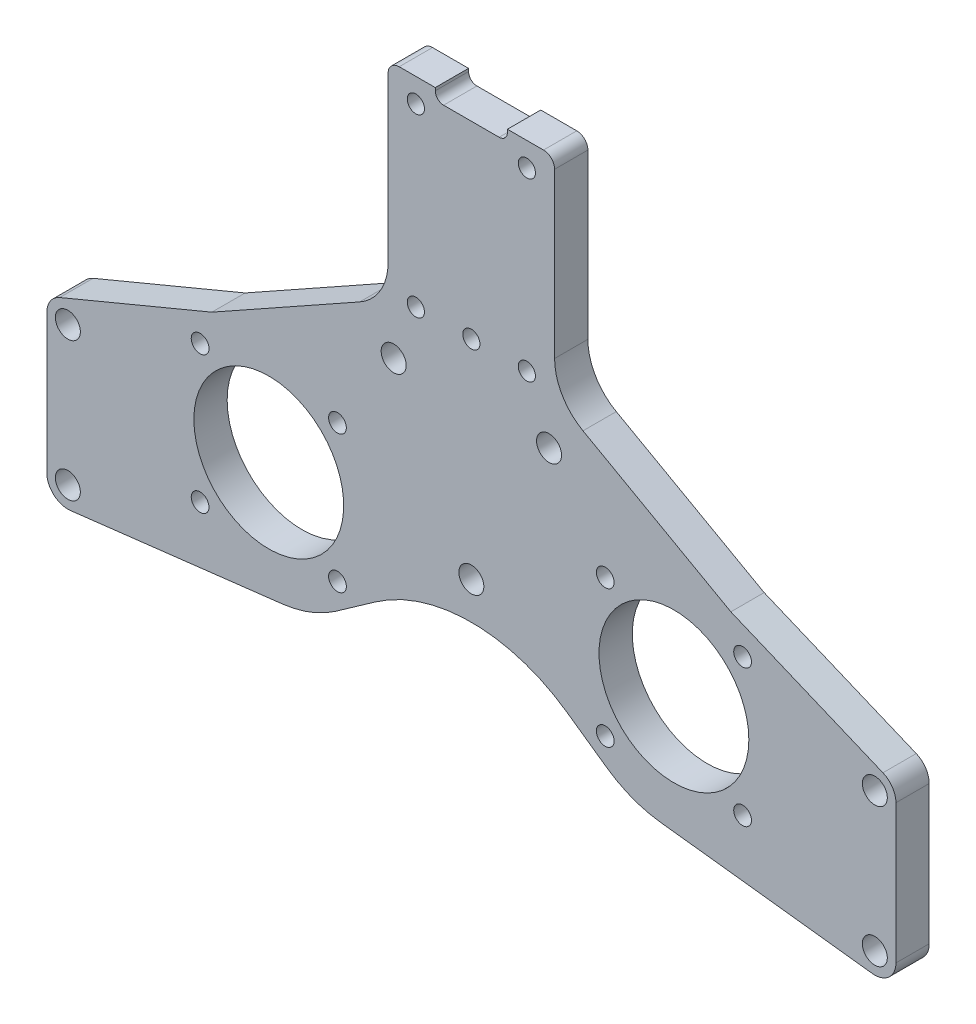
from build123d import *

# Parameters (mm, degrees)
SKETCH_1_R          = 2.25
SKETCH_1_R_2        = 13.5
SKETCH_1_R_3        = 1.6
SKETCH_1_R_4        = 1.55
EXTRUDE_1_DEPTH     = 6
SKETCH_2_R          = 2.25
EXTRUDE_2_DEPTH     = 6
CUT_EXTRUDE_2_DEPTH = 10


with BuildPart() as part:
    # 草图1 → 凸台-拉伸1 (new body)
    with BuildSketch(Plane.XY):
        with BuildLine():
            Line((-20.113876697, 33.24519052), (-46.760858936, 18.322520948))
            ThreePointArc((-46.760858936, 18.322520948), (-54.272689389, -11.186219731), (-24.417808219, -17.176164932))
            Line((-24.417808219, -17.176164932), (-17.260273973, -12.141356418))
            ThreePointArc((-17.260273973, -12.141356418), (0, -6.678734892), (17.260273973, -12.141356418))
            Line((17.260273973, -12.141356418), (24.417808219, -17.176164932))
            ThreePointArc((24.417808219, -17.176164932), (54.272689389, -11.186219731), (46.760858936, 18.322520948))
            Line((46.760858936, 18.322520948), (20.113876697, 33.24519052))
            ThreePointArc((20.113876697, 33.24519052), (16.372681963, 36.913582704), (15, 41.970200496))
            Line((15, 41.970200496), (15, 71.5))
            ThreePointArc((15, 71.5), (14.414213562, 72.914213562), (13, 73.5))
            Line((13, 73.5), (-13, 73.5))
            ThreePointArc((-13, 73.5), (-14.414213562, 72.914213562), (-15, 71.5))
            Line((-15, 71.5), (-15, 41.970200496))
            ThreePointArc((-15, 41.970200496), (-16.372681963, 36.913582704), (-20.113876697, 33.24519052))
        make_face()
        with Locations((-14, 27.5)):
            Circle(SKETCH_1_R, mode=Mode.SUBTRACT)
        with Locations((14, 27.5)):
            Circle(SKETCH_1_R, mode=Mode.SUBTRACT)
        with Locations((36.5, 0)):
            Circle(SKETCH_1_R_2, mode=Mode.SUBTRACT)
        with Locations((24.125631329, 12.374368671)):
            Circle(SKETCH_1_R_3, mode=Mode.SUBTRACT)
        with Locations((48.874368671, 12.374368671)):
            Circle(SKETCH_1_R_3, mode=Mode.SUBTRACT)
        with Locations((48.874368671, -12.374368671)):
            Circle(SKETCH_1_R_3, mode=Mode.SUBTRACT)
        with Locations((24.125631329, -12.374368671)):
            Circle(SKETCH_1_R_3, mode=Mode.SUBTRACT)
        Circle(SKETCH_1_R, mode=Mode.SUBTRACT)
        with Locations(Location((-24.125631329, -12.374368671, 0), (0, 0, 180))):
            Circle(SKETCH_1_R_3, mode=Mode.SUBTRACT)
        with Locations(Location((-48.874368671, -12.374368671, 0), (0, 0, 180))):
            Circle(SKETCH_1_R_3, mode=Mode.SUBTRACT)
        with Locations(Location((-48.874368671, 12.374368671, 0), (0, 0, 180))):
            Circle(SKETCH_1_R_3, mode=Mode.SUBTRACT)
        with Locations(Location((-24.125631329, 12.374368671, 0), (0, 0, 180))):
            Circle(SKETCH_1_R_3, mode=Mode.SUBTRACT)
        with Locations(Location((-36.5, 0, 0), (0, 0, 180))):
            Circle(SKETCH_1_R_2, mode=Mode.SUBTRACT)
        with Locations((-10, 37.5)):
            Circle(SKETCH_1_R_4, mode=Mode.SUBTRACT)
        with Locations((10, 37.5)):
            Circle(SKETCH_1_R_4, mode=Mode.SUBTRACT)
        with Locations((-10, 69.2)):
            Circle(SKETCH_1_R_4, mode=Mode.SUBTRACT)
        with Locations((10, 69.2)):
            Circle(SKETCH_1_R_4, mode=Mode.SUBTRACT)
        with Locations((0, 37.5)):
            Circle(SKETCH_1_R_4, mode=Mode.SUBTRACT)
    extrude(amount=EXTRUDE_1_DEPTH)

    # 草图2 → 凸台-拉伸2 (add)
    # profile 1 of 2: a face of its own
    with BuildSketch(Plane(origin=(0, 0, 0), x_dir=(-1, 0, 0), z_dir=(0, 0, -1))):
        with BuildLine():
            Line((34.034193738, -20.854730866), (72.253806486, -25.373713204))
            ThreePointArc((72.253806486, -25.373713204), (75.224328093, -24.440381608), (76.5, -21.6))
            Line((76.5, -21.6), (76.5, 3.4))
            ThreePointArc((76.5, 3.4), (75.861721596, 5.507965026), (74.16130708, 6.907788708))
            Line((74.16130708, 6.907788708), (46.760858936, 18.322520948))
            ThreePointArc((46.760858936, 18.322520948), (56.47260565, -6.488067781), (34.034193738, -20.854730866))
        make_face()
        with Locations((72.7, 3.4)):
            Circle(SKETCH_2_R, mode=Mode.SUBTRACT)
        with Locations((72.7, -21.6)):
            Circle(SKETCH_2_R, mode=Mode.SUBTRACT)
    # profile 2 of 2: a face of its own
    with BuildSketch(Plane(origin=(0, 0, 0), x_dir=(-1, 0, 0), z_dir=(0, 0, -1))):
        with BuildLine():
            Line((-74.16130708, 6.907788708), (-46.760858936, 18.322520948))
            ThreePointArc((-46.760858936, 18.322520948), (-56.47260565, -6.488067781), (-34.034193738, -20.854730866))
            Line((-34.034193738, -20.854730866), (-72.253806486, -25.373713204))
            ThreePointArc((-72.253806486, -25.373713204), (-75.224328093, -24.440381608), (-76.5, -21.6))
            Line((-76.5, -21.6), (-76.5, 3.4))
            ThreePointArc((-76.5, 3.4), (-75.861721596, 5.507965026), (-74.16130708, 6.907788708))
        make_face()
        with Locations((-72.7, 3.4)):
            Circle(SKETCH_2_R, mode=Mode.SUBTRACT)
        with Locations((-72.7, -21.6)):
            Circle(SKETCH_2_R, mode=Mode.SUBTRACT)
    extrude(amount=-EXTRUDE_2_DEPTH)

    # 草图4 → 切除-拉伸2 (cut)
    with BuildSketch(Plane(origin=(0, 0, 0), x_dir=(-1, 0, 0), z_dir=(0, 0, -1))):
        with BuildLine():
            Line((6.5, 73.5), (-6.5, 73.5))
            Line((-6.5, 73.5), (-6.5, 73))
            ThreePointArc((-6.5, 73), (-6.060660172, 71.939339828), (-5, 71.5))
            Line((-5, 71.5), (5, 71.5))
            ThreePointArc((5, 71.5), (6.060660172, 71.939339828), (6.5, 73))
            Line((6.5, 73), (6.5, 73.5))
        make_face()
    extrude(amount=-CUT_EXTRUDE_2_DEPTH, mode=Mode.SUBTRACT)


solid = part.part
